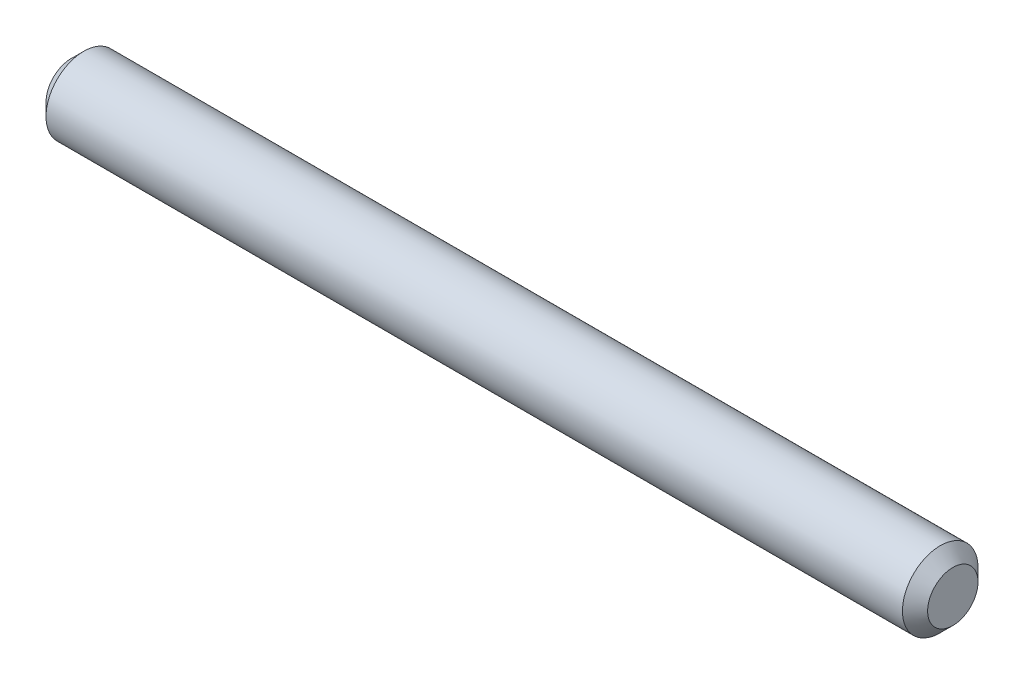
from build123d import *

# Parameters (mm, degrees)
SCHIZZO1_R                   = 3
ESTRUSIONE_ESTRUSIONE1_DEPTH = 70
SMUSSO1_SIZE                 = 1


with BuildPart() as part:
    # Schizzo1 → Estrusione-Estrusione1 (new body)
    with BuildSketch(Plane(origin=(0, 0, 0), x_dir=(0, 0, -1), z_dir=(1, 0, 0))):
        Circle(SCHIZZO1_R)
    extrude(amount=ESTRUSIONE_ESTRUSIONE1_DEPTH)

    # Smusso1
    smusso1_edges = [part.edges().sort_by_distance(p)[0] for p in [
        (0, 0, 3),
        (70, 0, 3),
    ]]
    chamfer(smusso1_edges, length=SMUSSO1_SIZE)


solid = part.part
